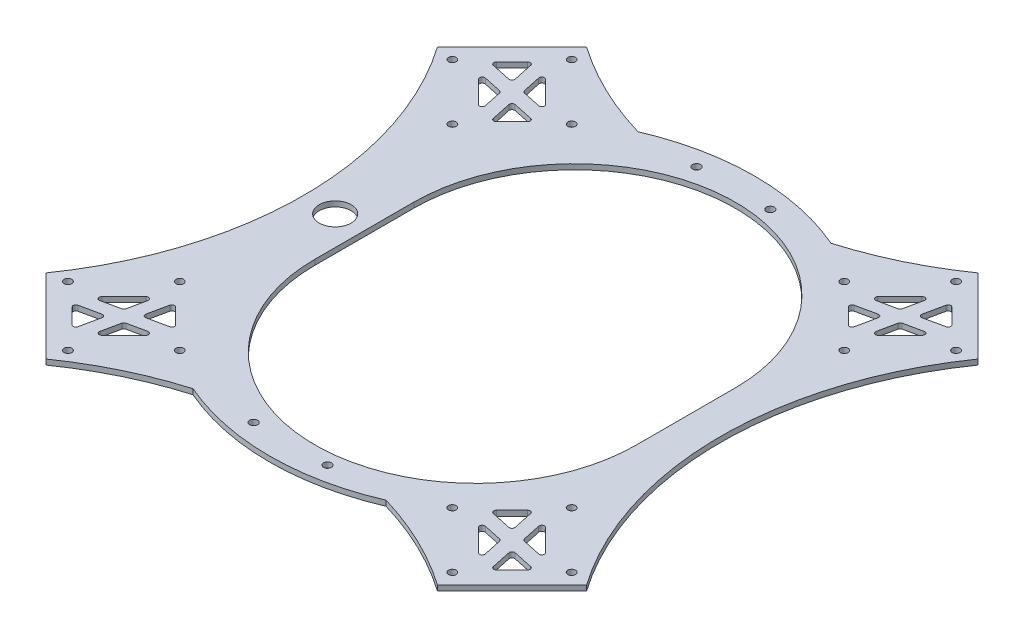
from build123d import *

# Parameters (mm, degrees)
EXTRUDE_1_DEPTH          = 2
HOLE_WIZARD_1_D          = 2.9
HOLE_WIZARD_1_DEPTH      = 100
CUT_EXTRUDE_2_DEPTH      = 146.013792447
CUT_EXTRUDE_2_DEPTH_BACK = 146.013792447
CUT_EXTRUDE_3_DEPTH      = 146.013792447
CUT_EXTRUDE_3_DEPTH_BACK = 146.013792447
SKETCH_8_R               = 129.444320441
CUT_EXTRUDE_4_DEPTH      = 146.013792447
CUT_EXTRUDE_4_DEPTH_BACK = 146.013792447
SKETCH_9_R               = 6.05
CUT_EXTRUDE_6_DEPTH      = 146.013792447
CUT_EXTRUDE_6_DEPTH_BACK = 146.013792447
SKETCH_11_R              = 60
EXTRUDE_3_DEPTH          = 2
HOLE_WIZARD_2_D          = 3
HOLE_WIZARD_2_DEPTH      = 100
CUT_EXTRUDE_7_DEPTH      = 146.013792447
CUT_EXTRUDE_7_DEPTH_BACK = 146.013792447


with BuildPart() as part:
    # 草图1 → 凸台-拉伸1 (new body)
    with BuildSketch(Plane(origin=(0, 0, 0), x_dir=(1, 0, 0), z_dir=(0, 1, 0))):
        Polygon((-74.246212025, 102.530483272), (-102.530483272, 74.246212025), (-102.530483272, -74.246212025), (-74.246212025, -102.530483272), (74.246212025, -102.530483272), (102.530483272, -74.246212025), (102.530483272, 74.246212025), (74.246212025, 102.530483272), align=None)
    extrude(amount=EXTRUDE_1_DEPTH)

    # 孔1
    with Locations(Plane(origin=(0, 2, 0), x_dir=(1, 0, 0), z_dir=(0, 1, 0))):
        with Locations((-95.539712665, 72.915895741), (-74.326509229, 51.702692305), (-51.699092231, 74.330109303), (-72.912295667, 95.543312739), (72.915895741, 95.539712665), (51.702692305, 74.326509229), (74.330109303, 51.699092231), (95.543312739, 72.912295667), (95.539712665, -72.915895741), (74.326509229, -51.702692305), (51.699092231, -74.330109303), (72.912295667, -95.543312739), (-72.915895741, -95.539712665), (-51.702692305, -74.326509229), (-74.330109303, -51.699092231), (-95.543312739, -72.912295667)):
            Hole(HOLE_WIZARD_1_D / 2, depth=HOLE_WIZARD_1_DEPTH)

    # 草图7 → 切除-拉伸2 (cut, two sides: drawn at the far end of the back side and taken through both)
    with BuildSketch(Plane(origin=(0, 2, 0), x_dir=(1, 0, 0), z_dir=(0, 1, 0)).offset(-CUT_EXTRUDE_2_DEPTH_BACK)):
        with BuildLine():
            Line((-86.393024897, 80.484175463), (-80.480575389, 86.396624971))
            ThreePointArc((-80.480575389, 86.396624971), (-79.489849579, 86.64845523), (-78.795493206, 85.89823837))
            Line((-78.795493206, 85.89823837), (-77.191282416, 78.381578071))
            ThreePointArc((-77.191282416, 78.381578071), (-77.462151036, 77.46575111), (-78.377977997, 77.194882489))
            Line((-78.377977997, 77.194882489), (-85.894638296, 78.79909328))
            ThreePointArc((-85.894638296, 78.79909328), (-86.644855156, 79.493449653), (-86.393024897, 80.484175463))
        make_face()
        with BuildLine():
            Line((-84.160083838, 71.435761851), (-75.806643119, 63.082321131))
            ThreePointArc((-75.806643119, 63.082321131), (-74.622014392, 62.91080809), (-74.121560936, 63.998148093))
            Line((-74.121560936, 63.998148093), (-75.590793382, 70.882356366))
            ThreePointArc((-75.590793382, 70.882356366), (-75.861662002, 71.380742967), (-76.360048603, 71.651611588))
            Line((-76.360048603, 71.651611588), (-83.244256877, 73.120844034))
            ThreePointArc((-83.244256877, 73.120844034), (-84.331596879, 72.620390577), (-84.160083838, 71.435761851))
        make_face()
        with BuildLine():
            Line((-71.432161777, 84.163683912), (-63.078721058, 75.810243193))
            ThreePointArc((-63.078721058, 75.810243193), (-62.907208017, 74.625614466), (-63.994548019, 74.12516101))
            Line((-63.994548019, 74.12516101), (-70.878756293, 75.594393456))
            ThreePointArc((-70.878756293, 75.594393456), (-71.377142893, 75.865262076), (-71.648011514, 76.363648677))
            Line((-71.648011514, 76.363648677), (-73.11724396, 83.247856951))
            ThreePointArc((-73.11724396, 83.247856951), (-72.616790503, 84.335196953), (-71.432161777, 84.163683912))
        make_face()
        with BuildLine():
            Line((-66.758229507, 60.849380072), (-60.845779998, 66.761829581))
            ThreePointArc((-60.845779998, 66.761829581), (-60.59394974, 67.752555391), (-61.344166599, 68.446911764))
            Line((-61.344166599, 68.446911764), (-68.860826898, 70.051122554))
            ThreePointArc((-68.860826898, 70.051122554), (-69.77665386, 69.780253934), (-70.04752248, 68.864426972))
            Line((-70.04752248, 68.864426972), (-68.44331169, 61.347766673))
            ThreePointArc((-68.44331169, 61.347766673), (-67.748955317, 60.597549814), (-66.758229507, 60.849380072))
        make_face()
        with BuildLine():
            Line((80.484175463, 86.393024897), (86.396624971, 80.480575389))
            ThreePointArc((86.396624971, 80.480575389), (86.64845523, 79.489849579), (85.89823837, 78.795493206))
            Line((85.89823837, 78.795493206), (78.381578071, 77.191282416))
            ThreePointArc((78.381578071, 77.191282416), (77.46575111, 77.462151036), (77.194882489, 78.377977997))
            Line((77.194882489, 78.377977997), (78.79909328, 85.894638296))
            ThreePointArc((78.79909328, 85.894638296), (79.493449653, 86.644855156), (80.484175463, 86.393024897))
        make_face()
        with BuildLine():
            Line((71.435761851, 84.160083838), (63.082321131, 75.806643119))
            ThreePointArc((63.082321131, 75.806643119), (62.91080809, 74.622014392), (63.998148093, 74.121560936))
            Line((63.998148093, 74.121560936), (70.882356366, 75.590793382))
            ThreePointArc((70.882356366, 75.590793382), (71.380742967, 75.861662002), (71.651611588, 76.360048603))
            Line((71.651611588, 76.360048603), (73.120844034, 83.244256877))
            ThreePointArc((73.120844034, 83.244256877), (72.620390577, 84.331596879), (71.435761851, 84.160083838))
        make_face()
        with BuildLine():
            Line((84.163683912, 71.432161777), (75.810243193, 63.078721058))
            ThreePointArc((75.810243193, 63.078721058), (74.625614466, 62.907208017), (74.12516101, 63.994548019))
            Line((74.12516101, 63.994548019), (75.594393456, 70.878756293))
            ThreePointArc((75.594393456, 70.878756293), (75.865262076, 71.377142893), (76.363648677, 71.648011514))
            Line((76.363648677, 71.648011514), (83.247856951, 73.11724396))
            ThreePointArc((83.247856951, 73.11724396), (84.335196953, 72.616790503), (84.163683912, 71.432161777))
        make_face()
        with BuildLine():
            Line((60.849380072, 66.758229507), (66.761829581, 60.845779998))
            ThreePointArc((66.761829581, 60.845779998), (67.752555391, 60.59394974), (68.446911764, 61.344166599))
            Line((68.446911764, 61.344166599), (70.051122554, 68.860826898))
            ThreePointArc((70.051122554, 68.860826898), (69.780253934, 69.77665386), (68.864426972, 70.04752248))
            Line((68.864426972, 70.04752248), (61.347766673, 68.44331169))
            ThreePointArc((61.347766673, 68.44331169), (60.597549814, 67.748955317), (60.849380072, 66.758229507))
        make_face()
        with BuildLine():
            Line((86.393024897, -80.484175463), (80.480575389, -86.396624971))
            ThreePointArc((80.480575389, -86.396624971), (79.489849579, -86.64845523), (78.795493206, -85.89823837))
            Line((78.795493206, -85.89823837), (77.191282416, -78.381578071))
            ThreePointArc((77.191282416, -78.381578071), (77.462151036, -77.46575111), (78.377977997, -77.194882489))
            Line((78.377977997, -77.194882489), (85.894638296, -78.79909328))
            ThreePointArc((85.894638296, -78.79909328), (86.644855156, -79.493449653), (86.393024897, -80.484175463))
        make_face()
        with BuildLine():
            Line((84.160083838, -71.435761851), (75.806643119, -63.082321131))
            ThreePointArc((75.806643119, -63.082321131), (74.622014392, -62.91080809), (74.121560936, -63.998148093))
            Line((74.121560936, -63.998148093), (75.590793382, -70.882356366))
            ThreePointArc((75.590793382, -70.882356366), (75.861662002, -71.380742967), (76.360048603, -71.651611588))
            Line((76.360048603, -71.651611588), (83.244256877, -73.120844034))
            ThreePointArc((83.244256877, -73.120844034), (84.331596879, -72.620390577), (84.160083838, -71.435761851))
        make_face()
        with BuildLine():
            Line((71.432161777, -84.163683912), (63.078721058, -75.810243193))
            ThreePointArc((63.078721058, -75.810243193), (62.907208017, -74.625614466), (63.994548019, -74.12516101))
            Line((63.994548019, -74.12516101), (70.878756293, -75.594393456))
            ThreePointArc((70.878756293, -75.594393456), (71.377142893, -75.865262076), (71.648011514, -76.363648677))
            Line((71.648011514, -76.363648677), (73.11724396, -83.247856951))
            ThreePointArc((73.11724396, -83.247856951), (72.616790503, -84.335196953), (71.432161777, -84.163683912))
        make_face()
        with BuildLine():
            Line((66.758229507, -60.849380072), (60.845779998, -66.761829581))
            ThreePointArc((60.845779998, -66.761829581), (60.59394974, -67.752555391), (61.344166599, -68.446911764))
            Line((61.344166599, -68.446911764), (68.860826898, -70.051122554))
            ThreePointArc((68.860826898, -70.051122554), (69.77665386, -69.780253934), (70.04752248, -68.864426972))
            Line((70.04752248, -68.864426972), (68.44331169, -61.347766673))
            ThreePointArc((68.44331169, -61.347766673), (67.748955317, -60.597549814), (66.758229507, -60.849380072))
        make_face()
        with BuildLine():
            Line((-80.484175463, -86.393024897), (-86.396624971, -80.480575389))
            ThreePointArc((-86.396624971, -80.480575389), (-86.64845523, -79.489849579), (-85.89823837, -78.795493206))
            Line((-85.89823837, -78.795493206), (-78.381578071, -77.191282416))
            ThreePointArc((-78.381578071, -77.191282416), (-77.46575111, -77.462151036), (-77.194882489, -78.377977997))
            Line((-77.194882489, -78.377977997), (-78.79909328, -85.894638296))
            ThreePointArc((-78.79909328, -85.894638296), (-79.493449653, -86.644855156), (-80.484175463, -86.393024897))
        make_face()
        with BuildLine():
            Line((-71.435761851, -84.160083838), (-63.082321131, -75.806643119))
            ThreePointArc((-63.082321131, -75.806643119), (-62.91080809, -74.622014392), (-63.998148093, -74.121560936))
            Line((-63.998148093, -74.121560936), (-70.882356366, -75.590793382))
            ThreePointArc((-70.882356366, -75.590793382), (-71.380742967, -75.861662002), (-71.651611588, -76.360048603))
            Line((-71.651611588, -76.360048603), (-73.120844034, -83.244256877))
            ThreePointArc((-73.120844034, -83.244256877), (-72.620390577, -84.331596879), (-71.435761851, -84.160083838))
        make_face()
        with BuildLine():
            Line((-84.163683912, -71.432161777), (-75.810243193, -63.078721058))
            ThreePointArc((-75.810243193, -63.078721058), (-74.625614466, -62.907208017), (-74.12516101, -63.994548019))
            Line((-74.12516101, -63.994548019), (-75.594393456, -70.878756293))
            ThreePointArc((-75.594393456, -70.878756293), (-75.865262076, -71.377142893), (-76.363648677, -71.648011514))
            Line((-76.363648677, -71.648011514), (-83.247856951, -73.11724396))
            ThreePointArc((-83.247856951, -73.11724396), (-84.335196953, -72.616790503), (-84.163683912, -71.432161777))
        make_face()
        with BuildLine():
            Line((-60.849380072, -66.758229507), (-66.761829581, -60.845779998))
            ThreePointArc((-66.761829581, -60.845779998), (-67.752555391, -60.59394974), (-68.446911764, -61.344166599))
            Line((-68.446911764, -61.344166599), (-70.051122554, -68.860826898))
            ThreePointArc((-70.051122554, -68.860826898), (-69.780253934, -69.77665386), (-68.864426972, -70.04752248))
            Line((-68.864426972, -70.04752248), (-61.347766673, -68.44331169))
            ThreePointArc((-61.347766673, -68.44331169), (-60.597549814, -67.748955317), (-60.849380072, -66.758229507))
        make_face()
    extrude(amount=CUT_EXTRUDE_2_DEPTH + CUT_EXTRUDE_2_DEPTH_BACK, mode=Mode.SUBTRACT)

    # 草图8 → 切除-拉伸3 (cut, two sides: drawn at the far end of the back side and taken through both)
    with BuildSketch(Plane(origin=(0, 2, 0), x_dir=(1, 0, 0), z_dir=(0, 1, 0)).offset(-CUT_EXTRUDE_3_DEPTH_BACK)):
        with Locations((-208.565062983, 0)):
            Circle(SKETCH_8_R)
        with Locations((0, 208.565062983)):
            Circle(SKETCH_8_R)
        with Locations((208.565062983, 0)):
            Circle(SKETCH_8_R)
        with Locations((0, -208.565062983)):
            Circle(SKETCH_8_R)
    extrude(amount=CUT_EXTRUDE_3_DEPTH + CUT_EXTRUDE_3_DEPTH_BACK, mode=Mode.SUBTRACT)

    # 草图9 → 切除-拉伸4 (cut, two sides: drawn at the far end of the back side and taken through both)
    with BuildSketch(Plane(origin=(0, 2, 0), x_dir=(1, 0, 0), z_dir=(0, 1, 0)).offset(-CUT_EXTRUDE_4_DEPTH_BACK)):
        with Locations(Location((-67.070742542, 0, 0), (0, 0, 270))):
            Circle(SKETCH_9_R)
    extrude(amount=CUT_EXTRUDE_4_DEPTH + CUT_EXTRUDE_4_DEPTH_BACK, mode=Mode.SUBTRACT)

    # 草图11 → 切除-拉伸6 (cut, two sides: drawn at the far end of the back side and taken through both)
    with BuildSketch(Plane(origin=(0, 2, 0), x_dir=(1, 0, 0), z_dir=(0, 1, 0)).offset(-CUT_EXTRUDE_6_DEPTH_BACK)):
        with Locations(Location((5.979257458, 0, 0), (0, 0, 270))):
            Circle(SKETCH_11_R)
    extrude(amount=CUT_EXTRUDE_6_DEPTH + CUT_EXTRUDE_6_DEPTH_BACK, mode=Mode.SUBTRACT)

    # 草图15 → 凸台-拉伸3 (add)
    with BuildSketch(Plane(origin=(0, 2, 0), x_dir=(1, 0, 0), z_dir=(0, 1, 0))):
        with BuildLine():
            Line((-40.341181006, 82.683668974), (-31.918521189, 62.685196363))
            ThreePointArc((-31.918521189, 62.685196363), (2.489785707, 70.299550533), (36.273204046, 60.270063101))
            Line((36.273204046, 60.270063101), (44.635831637, 80.446519714))
            ThreePointArc((44.635831637, 80.446519714), (20.19771856, 89.755513285), (-5.872340426, 91.812393597))
            ThreePointArc((-5.872340426, 91.812393597), (-23.553254426, 88.93393169), (-40.341181006, 82.683668974))
        make_face()
        with BuildLine():
            Line((-42.42945176, -81.631743969), (-34.531619798, -61.284525552))
            ThreePointArc((-34.531619798, -61.284525552), (0.010434557, -70.343626073), (34.549799794, -61.274278226))
            Line((34.549799794, -61.274278226), (41.391005983, -82.163158555))
            ThreePointArc((41.391005983, -82.163158555), (18.403011573, -90.140607747), (-5.872340426, -91.812393597))
            ThreePointArc((-5.872340426, -91.812393597), (-24.681515124, -88.627438253), (-42.42945176, -81.631743969))
        make_face()
    extrude(amount=-EXTRUDE_3_DEPTH)

    # 孔2
    with Locations(Plane(origin=(0, 2, 0), x_dir=(1, 0, 0), z_dir=(0, 1, 0))):
        with Locations((-14, 154), (14, 154), (-14, -154), (14, -154), (-14, -84), (14, -84), (-14, 84), (14, 84)):
            Hole(HOLE_WIZARD_2_D / 2, depth=HOLE_WIZARD_2_DEPTH)

    # 草图18 → 切除-拉伸7 (cut, two sides: drawn at the far end of the back side and taken through both)
    with BuildSketch(Plane(origin=(0, 2, 0), x_dir=(1, 0, 0), z_dir=(0, 1, 0)).offset(-CUT_EXTRUDE_7_DEPTH_BACK)):
        with BuildLine():
            Line((65.979257458, 18.75), (65.979257458, -18.75))
            ThreePointArc((65.979257458, -18.75), (4.979257458, -79.75), (-56.020742542, -18.75))
            Line((-56.020742542, -18.75), (-56.020742542, 18.75))
            ThreePointArc((-56.020742542, 18.75), (4.979257458, 79.75), (65.979257458, 18.75))
        make_face()
    extrude(amount=CUT_EXTRUDE_7_DEPTH + CUT_EXTRUDE_7_DEPTH_BACK, mode=Mode.SUBTRACT)


solid = part.part
